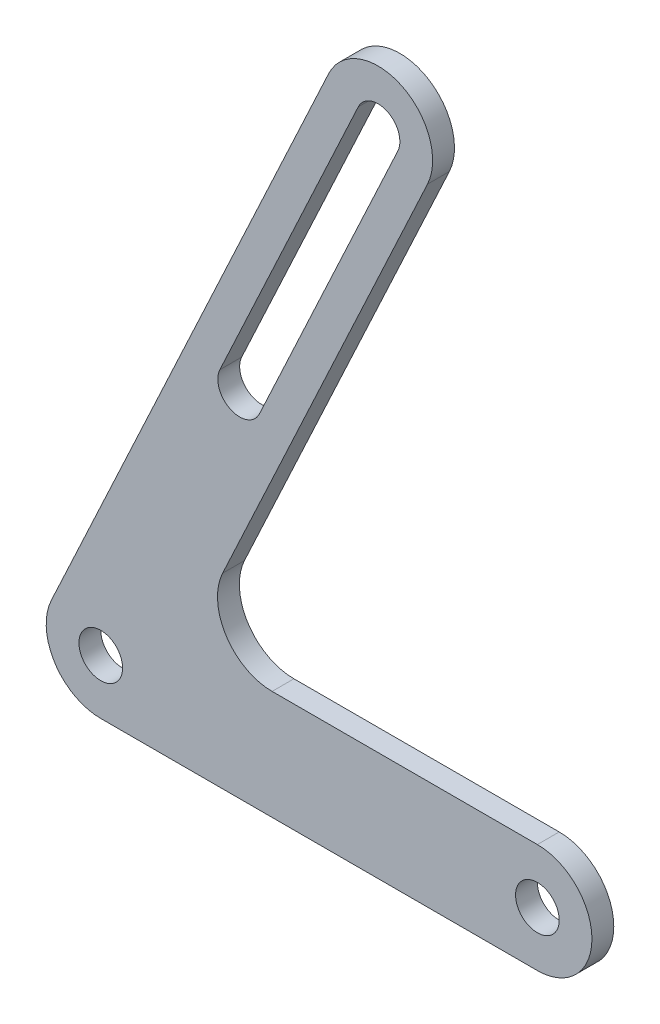
from build123d import *

# Parameters (mm, degrees)
BOSS_EXTRUDE1_DEPTH     = 2
CUT_EXTRUDE1_DEPTH      = 4
CUT_EXTRUDE1_DEPTH_BACK = 150.177687816
SKETCH2_R               = 4
FILLET1_R               = 10


with BuildPart() as part:
    # Sketch1 → Boss-Extrude1 (new, symmetric)
    with BuildSketch(Plane.XY):
        with BuildLine():
            Line((41.742866429, 113.179881771), (-9.06307787, 4.226182617))
            ThreePointArc((-9.06307787, 4.226182617), (-5.372996083, 8.433914458), (0, 10))
            Line((0, 10), (15.696855771, 10))
            Line((15.696855771, 10), (59.86902217, 104.727516536))
            ThreePointArc((59.86902217, 104.727516536), (55.032126917, 118.016777024), (41.742866429, 113.179881771))
        make_face()
        with BuildLine():
            ThreePointArc((0, 10), (-5.372996083, 8.433914458), (-9.06307787, 4.226182617))
            ThreePointArc((-9.06307787, 4.226182617), (-8.433914458, -5.372996083), (0, -10))
            ThreePointArc((0, -10), (5.372996083, -8.433914458), (9.06307787, -4.226182617))
            Line((9.06307787, -4.226182617), (15.696855771, 10))
            Line((15.696855771, 10), (0, 10))
        make_face()
        with BuildLine():
            ThreePointArc((9.06307787, -4.226182617), (5.372996083, -8.433914458), (0, -10))
            Line((0, -10), (80, -10))
            ThreePointArc((80, -10), (90, 0), (80, 10))
            Line((80, 10), (15.696855771, 10))
            Line((15.696855771, 10), (9.06307787, -4.226182617))
        make_face()
    extrude(amount=BOSS_EXTRUDE1_DEPTH, both=True)

    # Sketch2 → Cut-Extrude1 (cut, two sides: drawn at the far end of the back side and taken through both)
    with BuildSketch(Plane.XY.offset(-CUT_EXTRUDE1_DEPTH_BACK)):
        Circle(SKETCH2_R)
        with Locations((80, 0)):
            Circle(SKETCH2_R)
        with BuildLine():
            Line((54.431175448, 107.263226106), (29.074079743, 52.884758884))
            ThreePointArc((29.074079743, 52.884758884), (23.758375548, 50.950000783), (21.823617447, 56.265704978))
            Line((21.823617447, 56.265704978), (47.180713151, 110.6441722))
            ThreePointArc((47.180713151, 110.6441722), (52.496417346, 112.578930301), (54.431175448, 107.263226106))
        make_face()
    extrude(amount=CUT_EXTRUDE1_DEPTH + CUT_EXTRUDE1_DEPTH_BACK, mode=Mode.SUBTRACT)

    # Fillet1
    fillet1_edges = [part.edges().sort_by_distance(p)[0] for p in [
        (15.696855771, 10, 0),
    ]]
    fillet(fillet1_edges, radius=FILLET1_R)


solid = part.part
